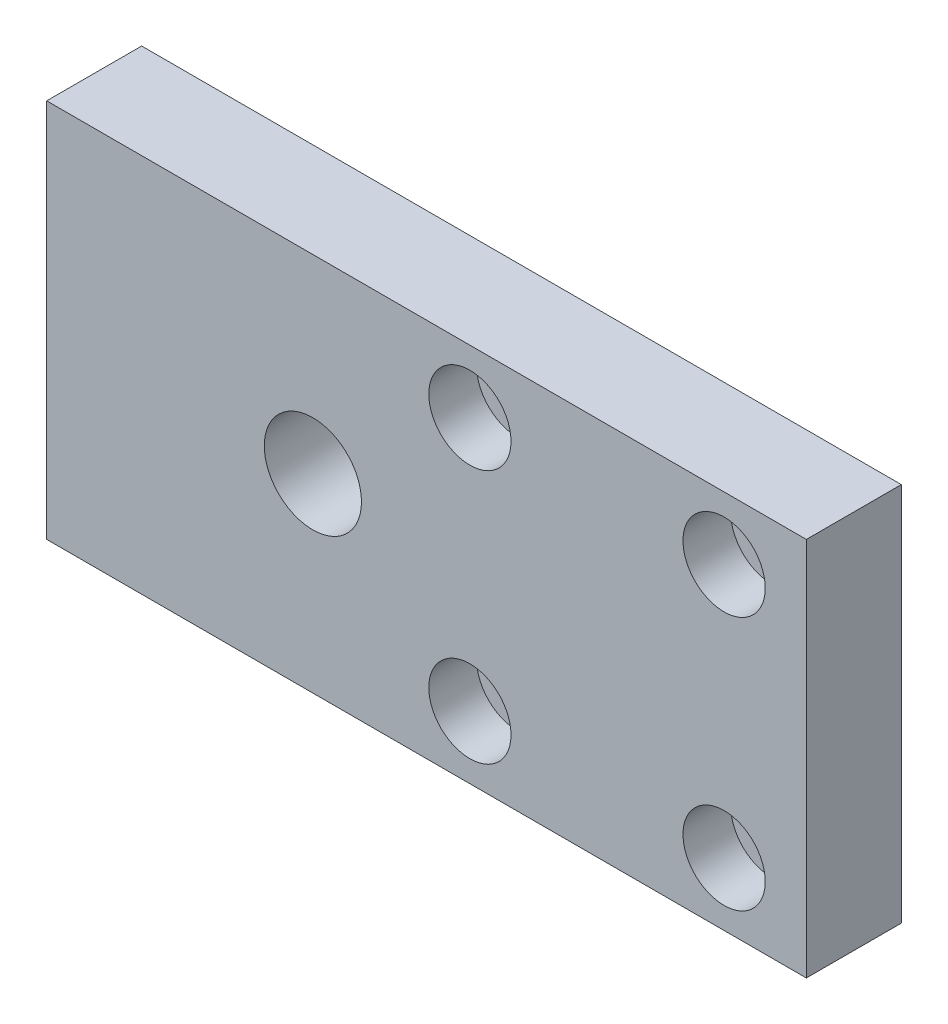
from build123d import *

# Parameters (mm, degrees)
CROQUIS1_W                                           = 101.6
CROQUIS1_H                                           = 50.8
CROQUIS1_R                                           = 6.5
SALIENTE_EXTRUIR1_DEPTH                              = 6.35
REFRENTADO_PARA_TORNILLO_CON_CABEZA_HUEC_D           = 6.6
REFRENTADO_PARA_TORNILLO_CON_CABEZA_HUEC_CBORE_D     = 11
REFRENTADO_PARA_TORNILLO_CON_CABEZA_HUEC_CBORE_DEPTH = 6.4


with BuildPart() as part:
    # Croquis1 → Saliente-Extruir1 (new, symmetric)
    with BuildSketch(Plane.XY):
        Rectangle(CROQUIS1_W, CROQUIS1_H)
        with Locations((-15.2, 0)):
            Circle(CROQUIS1_R, mode=Mode.SUBTRACT)
    extrude(amount=SALIENTE_EXTRUIR1_DEPTH, both=True)

    # Refrentado para tornillo con cabeza hueca de M61 (through all)
    with Locations(Plane.XY.offset(6.35)):
        with Locations((5.8, 17), (39.8, 17), (39.8, -17), (5.8, -17)):
            CounterBoreHole(REFRENTADO_PARA_TORNILLO_CON_CABEZA_HUEC_D / 2, REFRENTADO_PARA_TORNILLO_CON_CABEZA_HUEC_CBORE_D / 2, REFRENTADO_PARA_TORNILLO_CON_CABEZA_HUEC_CBORE_DEPTH)


solid = part.part
